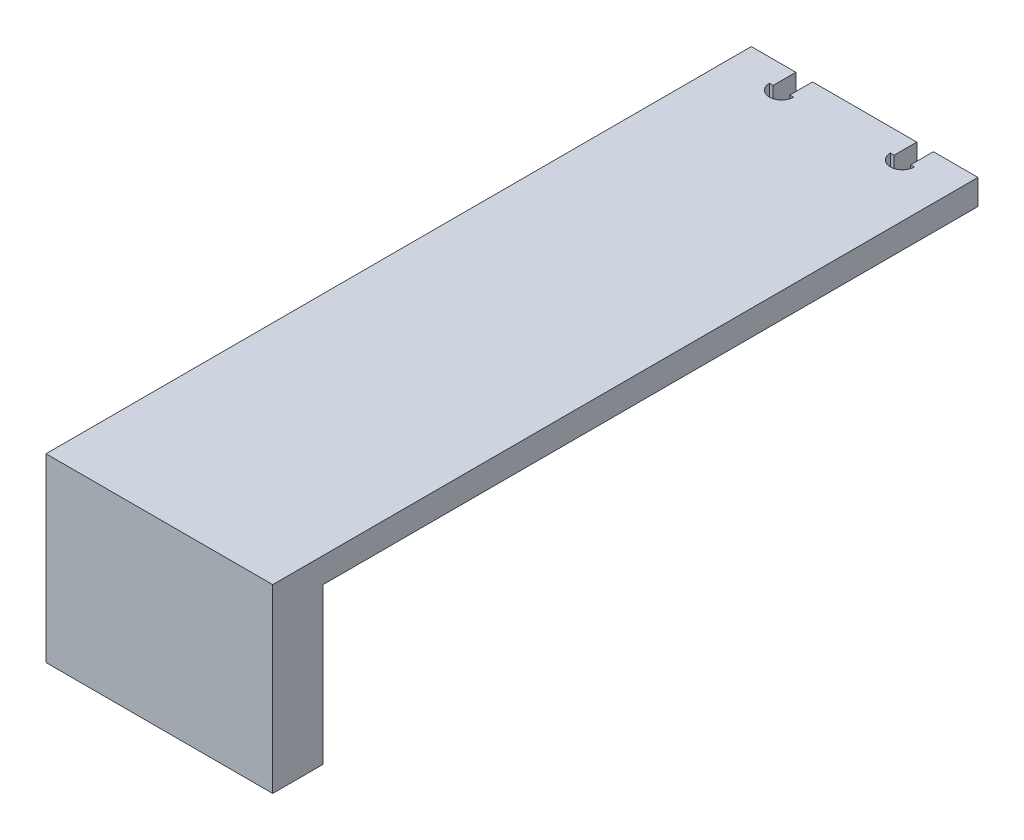
from build123d import *

# Parameters (mm, degrees)
BOSS_EXTRUDE1_DEPTH = 2.5
SKETCH4_W           = 54.285
SKETCH4_H           = 130
CUT_EXTRUDE1_DEPTH  = 120
SKETCH5_W           = 10
SKETCH5_H           = 35.9
BOSS_EXTRUDE2_DEPTH = 22.5


with BuildPart() as part:
    # Sketch2 → Boss-Extrude1 (new, symmetric)
    with BuildSketch(Plane(origin=(0, 0, 0), x_dir=(1, 0, 0), z_dir=(0, 1, 0))):
        with BuildLine():
            Line((-13.65, 65), (-76.785, 65))
            Line((-76.785, 65), (-76.785, -65))
            Line((-76.785, -65), (76.785, -65))
            Line((76.785, -65), (76.785, 65))
            Line((76.785, 65), (13.65, 65))
            Line((13.65, 65), (13.65, 60.5))
            Line((13.65, 60.5), (14.4, 60.5))
            ThreePointArc((14.4, 60.5), (12, 58.1), (9.6, 60.5))
            Line((9.6, 60.5), (10.35, 60.5))
            Line((10.35, 60.5), (10.35, 65))
            Line((10.35, 65), (-10.35, 65))
            Line((-10.35, 65), (-10.35, 60.5))
            Line((-10.35, 60.5), (-9.6, 60.5))
            ThreePointArc((-9.6, 60.5), (-12, 58.1), (-14.4, 60.5))
            Line((-14.4, 60.5), (-13.65, 60.5))
            Line((-13.65, 60.5), (-13.65, 65))
        make_face()
    extrude(amount=BOSS_EXTRUDE1_DEPTH, both=True)

    # Sketch4 → Cut-Extrude1 (cut)
    with BuildSketch(Plane(origin=(0, 2.5, 0), x_dir=(1, 0, 0), z_dir=(0, 1, 0))):
        with Locations((-49.6425, 0)):
            Rectangle(SKETCH4_W, SKETCH4_H)
        with Locations((49.6425, 0)):
            Rectangle(SKETCH4_W, SKETCH4_H)
    extrude(amount=-CUT_EXTRUDE1_DEPTH, mode=Mode.SUBTRACT)

    # Sketch5 → Boss-Extrude2 (add, symmetric)
    with BuildSketch(Plane(origin=(0, 0, 0), x_dir=(0, 0, -1), z_dir=(1, 0, 0))):
        with Locations((-70, -15.45)):
            Rectangle(SKETCH5_W, SKETCH5_H)
    extrude(amount=BOSS_EXTRUDE2_DEPTH, both=True)


solid = part.part
